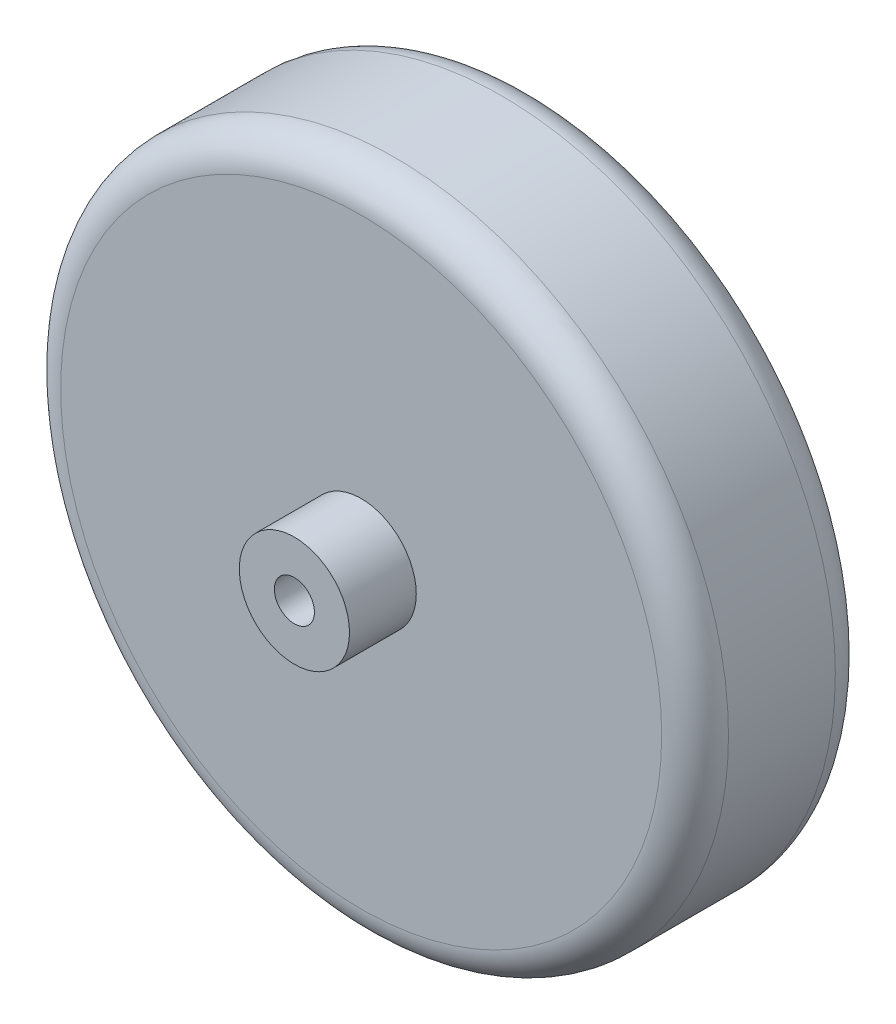
from build123d import *

# Parameters (mm, degrees)
SKETCH1_R           = 50
SKETCH1_R_2         = 3
BOSS_EXTRUDE1_DEPTH = 26
FILLET2_R           = 5
SKETCH3_R           = 8.248611849
BOSS_EXTRUDE2_DEPTH = 10
CUT_EXTRUDE1_START  = -26
SKETCH4_R           = 3
CUT_EXTRUDE1_DEPTH  = 26


with BuildPart() as part:
    # Sketch1 → Boss-Extrude1 (new body)
    with BuildSketch(Plane.XY):
        with Locations(Location((0, 0, 0), (0, 0, 180))):
            Circle(SKETCH1_R)
        with Locations(Location((0, 0, 0), (0, 0, 180))):
            Circle(SKETCH1_R_2, mode=Mode.SUBTRACT)
    extrude(amount=BOSS_EXTRUDE1_DEPTH)

    # Fillet2
    fillet2_edges = [part.edges().sort_by_distance(p)[0] for p in [
        (50, 0, 0),
        (50, 0, 26),
    ]]
    fillet(fillet2_edges, radius=FILLET2_R)

    # Sketch3 → Boss-Extrude2 (add)
    with BuildSketch(Plane.XY.offset(26)):
        Circle(SKETCH3_R)
    extrude(amount=BOSS_EXTRUDE2_DEPTH)

    # Sketch4 → Cut-Extrude1 (cut)
    with BuildSketch(Plane.XY.offset(36).offset(CUT_EXTRUDE1_START)):
        with Locations(Location((0, 0, 0), (0, 0, 180))):
            Circle(SKETCH4_R)
    extrude(amount=CUT_EXTRUDE1_DEPTH, mode=Mode.SUBTRACT)


solid = part.part
